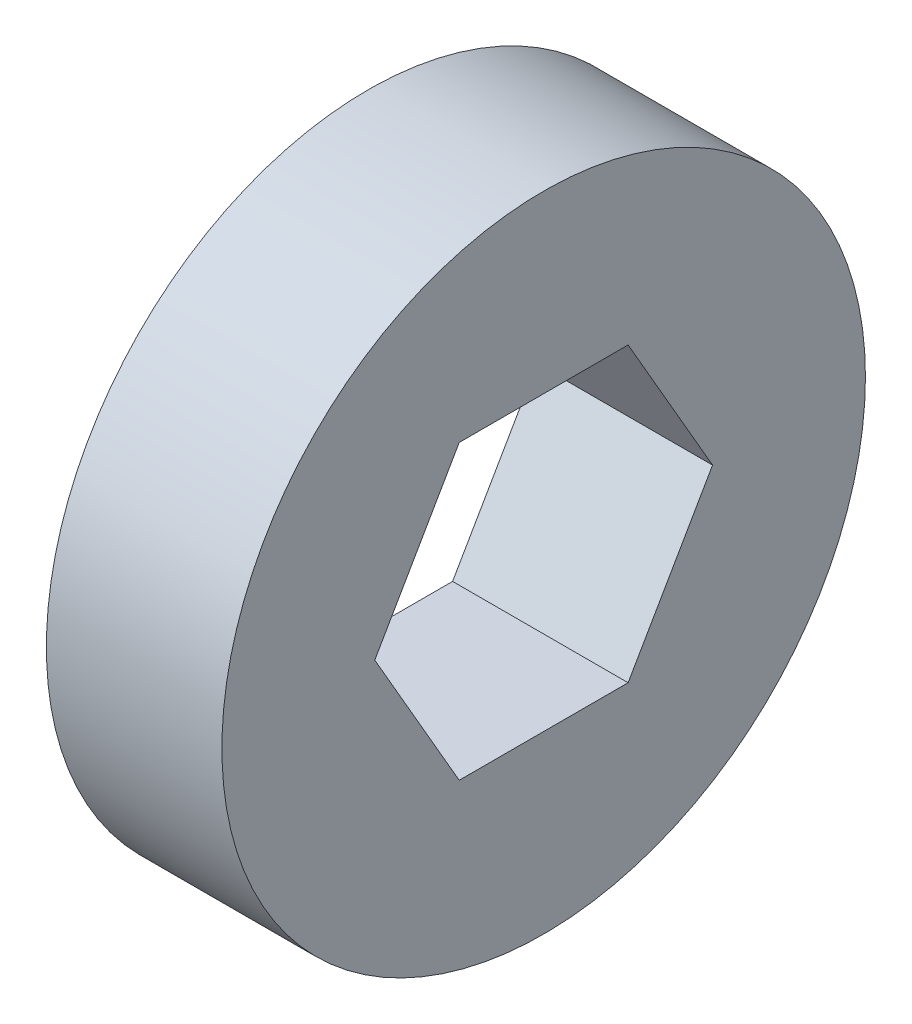
from build123d import *

# Parameters (mm, degrees)
SKETCH_1_R      = 5.5
EXTRUDE_1_DEPTH = 3


with BuildPart() as part:
    # 草图1 → 凸台-拉伸1 (new body)
    with BuildSketch(Plane(origin=(0, 0, 0), x_dir=(0, 0, -1), z_dir=(1, 0, 0))):
        Circle(SKETCH_1_R)
        Polygon((2.886751346, 0), (1.443375673, 2.5), (-1.443375673, 2.5), (-2.886751346, 0), (-1.443375673, -2.5), (1.443375673, -2.5), align=None, mode=Mode.SUBTRACT)
    extrude(amount=EXTRUDE_1_DEPTH)


solid = part.part
